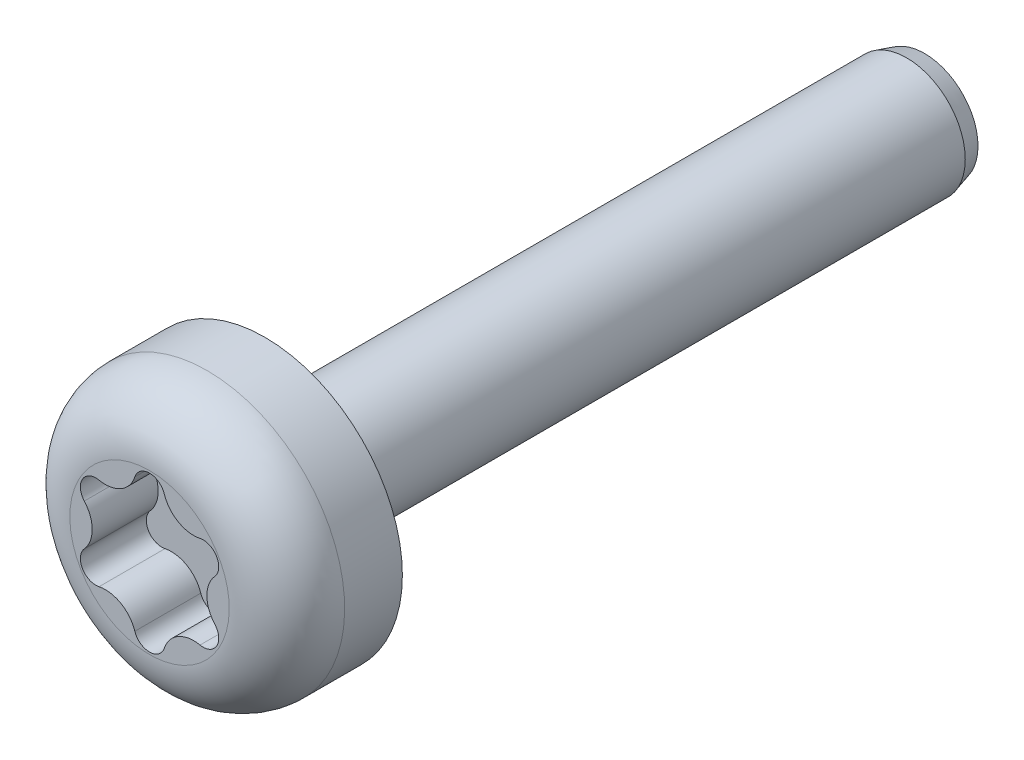
from build123d import *

# Parameters (mm, degrees)
SKETCH1_R          = 2.5
EXTRUDE3_DEPTH     = 2.1
SKETCH4_W          = 12
SKETCH4_H          = 1.065
CUT_EXTRUDE1_DEPTH = 1.2
CIRPATTERN1_COUNT  = 6


with BuildPart() as part:
    # Sketch1 → Extrude3 (new body)
    with BuildSketch(Plane.XY):
        Circle(SKETCH1_R)
    extrude(amount=EXTRUDE3_DEPTH)

    # Sketch11 → Cut-Revolve3 (revolve, cut)
    with BuildSketch(Plane(origin=(0, 0, 0), x_dir=(0, 0, -1), z_dir=(1, 0, 0))):
        with BuildLine():
            Line((-1.05, 2.5), (-1.05, 2.6))
            Line((-1.05, 2.6), (-2.2, 2.6))
            Line((-2.2, 2.6), (-2.2, 1.45))
            Line((-2.2, 1.45), (-2.1, 1.45))
            ThreePointArc((-2.1, 1.45), (-1.79246212, 2.19246212), (-1.05, 2.5))
        make_face()
    revolve(axis=Axis((0, 0, 0), (0, 0, 1)), mode=Mode.SUBTRACT)

    # Sketch12 → Cut-Extrude1 (cut)
    with BuildSketch(Plane.XY.offset(2.1)):
        with BuildLine():
            Line((-0.521538904, 0.90333188), (0, 0))
            Line((0, 0), (0.521538904, 0.90333188))
            ThreePointArc((0.521538904, 0.90333188), (0.365871935, 1.036061368), (0.267812968, 1.215599001))
            ThreePointArc((0.267812968, 1.215599001), (0, 1.4095), (-0.267812968, 1.215599001))
            ThreePointArc((-0.267812968, 1.215599001), (-0.365871935, 1.036061368), (-0.521538904, 0.90333188))
        make_face()
    cut_extrude1 = extrude(amount=-CUT_EXTRUDE1_DEPTH, mode=Mode.SUBTRACT)

    # CirPattern1: Cut-Extrude1 ×6 about axis
    cirpattern1_axis = Axis((0, 0, 2.1), (0, 0, -1))
    for i in range(1, CIRPATTERN1_COUNT):
        add(cut_extrude1.rotate(cirpattern1_axis, i * 360 / CIRPATTERN1_COUNT), mode=Mode.SUBTRACT)


with BuildPart() as body_2:
    # Sketch4 → Revolve1 (revolve)
    with BuildSketch(Plane(origin=(0, 0, 0), x_dir=(0, 0, -1), z_dir=(1, 0, 0))):
        with Locations((6, 0.5325)):
            Rectangle(SKETCH4_W, SKETCH4_H)
    revolve(axis=Axis((0, 0, -12), (0, 0, -1)))

    # Sketch13 → Cut-Revolve4 (revolve, cut)
    with BuildSketch(Plane(origin=(0, 0, 0), x_dir=(0, 0, -1), z_dir=(1, 0, 0))):
        Polygon((12, 0.9725), (10.15, 1.5), (12, 1.5), (13.27, 1.5), (13.27, 0), (12, 0), align=None)
    revolve(axis=Axis((0, 0, 0), (0, 0, -1)), mode=Mode.SUBTRACT)


solid = Compound([part.part, body_2.part])
